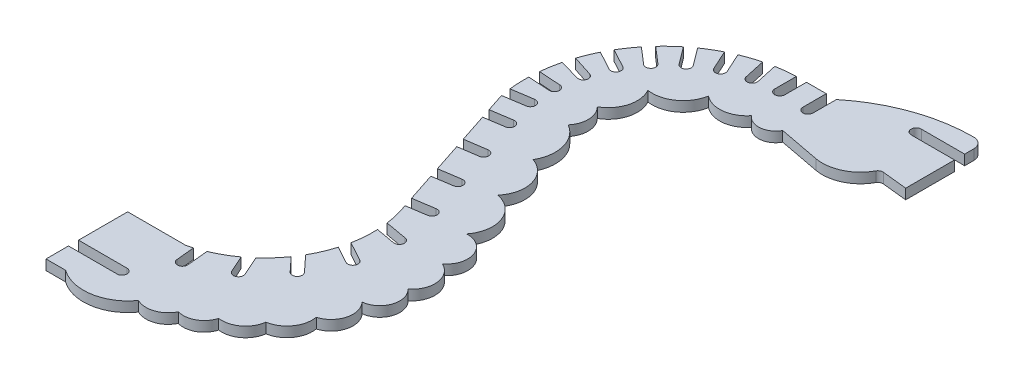
from build123d import *

# Parameters (mm, degrees)
BOSS_EXTRUDE1_DEPTH = 3


with BuildPart() as part:
    # Sketch3 → Boss-Extrude1 (new body)
    with BuildSketch(Plane(origin=(0, 0, 0), x_dir=(1, 0, 0), z_dir=(0, 1, 0))):
        with BuildLine():
            Line((0.591679445, -30.420098318), (0.591679445, -37.330098318))
            ThreePointArc((0.591679445, -37.330098318), (-0.908320555, -38.830098318), (-2.408320555, -37.330098318))
            Line((-2.408320555, -37.330098318), (-2.408320555, -30.420098318))
            Line((-2.408320555, -30.420098318), (-8.258320555, -30.420098318))
            Line((-8.258320555, -30.420098318), (-8.258320555, -36.830098318))
            ThreePointArc((-8.258320555, -36.830098318), (-9.758320555, -38.330098318), (-11.258320555, -36.830098318))
            Line((-11.258320555, -36.830098318), (-11.258320555, -30.420098318))
            ThreePointArc((-11.258320555, -30.420098318), (-14.157587017, -30.629396859), (-17.034731178, -31.04363517))
            Line((-17.034731178, -31.04363517), (-15.66681067, -37.305974468))
            ThreePointArc((-15.66681067, -37.305974468), (-16.812150481, -39.091526685), (-18.597702697, -37.946186875))
            Line((-18.597702697, -37.946186875), (-19.965623205, -31.683847576))
            ThreePointArc((-19.965623205, -31.683847576), (-22.753437017, -32.507040171), (-25.475903143, -33.525730554))
            Line((-25.475903143, -33.525730554), (-22.803084936, -39.351890767))
            ThreePointArc((-22.803084936, -39.351890767), (-23.540996482, -41.340731271), (-25.529836986, -40.602819725))
            Line((-25.529836986, -40.602819725), (-28.202655193, -34.776659512))
            ThreePointArc((-28.202655193, -34.776659512), (-30.750576247, -36.175820045), (-33.192934927, -37.752029415))
            Line((-33.192934927, -37.752029415), (-29.338361053, -42.873587796))
            ThreePointArc((-29.338361053, -42.873587796), (-29.634847287, -44.974086764), (-31.735346255, -44.67760053))
            Line((-31.735346255, -44.67760053), (-35.589920129, -39.556042149))
            ThreePointArc((-35.589920129, -39.556042149), (-37.780560653, -41.466708522), (-39.830287583, -43.52781779))
            Line((-39.830287583, -43.52781779), (-34.9715459, -47.708813994))
            ThreePointArc((-34.9715459, -47.708813994), (-34.812947114, -49.824197275), (-36.928330395, -49.982796061))
            Line((-36.928330395, -49.982796061), (-41.787072078, -45.801799857))
            ThreePointArc((-41.787072078, -45.801799857), (-43.519504922, -48.135943884), (-45.082165119, -50.586993661))
            Line((-45.082165119, -50.586993661), (-39.443107485, -53.634800906))
            ThreePointArc((-39.443107485, -53.634800906), (-38.836730639, -55.6676086), (-40.869538333, -56.273985446))
            Line((-40.869538333, -56.273985446), (-46.508595967, -53.226178201))
            ThreePointArc((-46.508595967, -53.226178201), (-47.665748765, -55.785413628), (-48.644932096, -58.417881781))
            Line((-48.644932096, -58.417881781), (-42.547032105, -60.378526572))
            ThreePointArc((-42.547032105, -60.378526572), (-41.520814182, -62.235103199), (-43.37739081, -63.261321122))
            Line((-43.37739081, -63.261321122), (-49.536961833, -61.487121356))
            ThreePointArc((-49.536961833, -61.487121356), (-50.138317317, -64.33104883), (-50.536616569, -67.210442795))
            Line((-50.536616569, -67.210442795), (-44.140315801, -67.629294183))
            ThreePointArc((-44.140315801, -67.629294183), (-42.741536695, -69.22410358), (-44.336346092, -70.622882686))
            Line((-44.336346092, -70.622882686), (-50.73264686, -70.204031298))
            ThreePointArc((-50.73264686, -70.204031298), (-50.713243641, -73.110777832), (-50.487893094, -76.008840811))
            Line((-50.487893094, -76.008840811), (-44.149552834, -75.053046508))
            ThreePointArc((-44.149552834, -75.053046508), (-42.442657071, -76.312612644), (-43.702223207, -78.019508408))
            Line((-43.702223207, -78.019508408), (-50.040563467, -78.975302711))
            Line((-50.040563467, -78.975302711), (-48.242175426, -84.448330276))
            Line((-48.242175426, -84.448330276), (-41.903835167, -83.492535972))
            ThreePointArc((-41.903835167, -83.492535972), (-40.196939403, -84.752102109), (-41.456505539, -86.458997873))
            Line((-41.456505539, -86.458997873), (-47.292325887, -87.339014346))
            Line((-47.292325887, -87.339014346), (-44.496146078, -95.848648873))
            Line((-44.496146078, -95.848648873), (-38.157805818, -94.89285457))
            ThreePointArc((-38.157805818, -94.89285457), (-36.450910055, -96.152420706), (-37.710476191, -97.85931647))
            Line((-37.710476191, -97.85931647), (-43.546296539, -98.739332944))
            Line((-43.546296539, -98.739332944), (-40.75011673, -107.248967471))
            Line((-40.75011673, -107.248967471), (-34.41177647, -106.293173167))
            ThreePointArc((-34.41177647, -106.293173167), (-32.704880706, -107.552739304), (-33.964446843, -109.259635067))
            Line((-33.964446843, -109.259635067), (-39.800267191, -110.139651541))
            Line((-39.800267191, -110.139651541), (-37.004087382, -118.649286068))
            Line((-37.004087382, -118.649286068), (-30.665747122, -117.693491765))
            ThreePointArc((-30.665747122, -117.693491765), (-28.958851358, -118.953057901), (-30.218417495, -120.659953665))
            Line((-30.218417495, -120.659953665), (-36.054237843, -121.539970138))
            Line((-36.054237843, -121.539970138), (-35.590669818, -122.95075011))
            ThreePointArc((-35.590669818, -122.95075011), (-34.806974696, -125.75946708), (-34.281042725, -128.627648207))
            Line((-34.281042725, -128.627648207), (-27.747875517, -129.78272529))
            ThreePointArc((-27.747875517, -129.78272529), (-26.531936776, -131.520969513), (-28.270180998, -132.736908254))
            Line((-28.270180998, -132.736908254), (-34.00913019, -131.722250511))
            ThreePointArc((-34.00913019, -131.722250511), (-34.075192309, -135.400732769), (-34.561150831, -139.04757253))
            Line((-34.561150831, -139.04757253), (-28.838758854, -142.17116811))
            ThreePointArc((-28.838758854, -142.17116811), (-28.240821524, -144.206474217), (-30.276127631, -144.804411546))
            Line((-30.276127631, -144.804411546), (-35.2935191, -142.065643934))
            ThreePointArc((-35.2935191, -142.065643934), (-36.539745877, -145.545336545), (-38.177184694, -148.858965366))
            Line((-38.177184694, -148.858965366), (-33.824418851, -153.564444036))
            ThreePointArc((-33.824418851, -153.564444036), (-33.906956954, -155.68415804), (-36.026670958, -155.601619937))
            Line((-36.026670958, -155.601619937), (-39.838521376, -151.480888091))
            ThreePointArc((-39.838521376, -151.480888091), (-42.144817333, -154.387016255), (-44.770614017, -157.008041575))
            Line((-44.770614017, -157.008041575), (-42.183941003, -162.772154464))
            ThreePointArc((-42.183941003, -162.772154464), (-42.938330746, -164.754803226), (-44.920979509, -164.000413483))
            Line((-44.920979509, -164.000413483), (-47.185290179, -158.954649194))
            ThreePointArc((-47.185290179, -158.954649194), (-50.311989567, -160.96907207), (-53.650455908, -162.608825429))
            Line((-53.650455908, -162.608825429), (-53.043901057, -168.832254262))
            ThreePointArc((-53.043901057, -168.832254262), (-54.391321871, -170.470685569), (-56.029753178, -169.123264755))
            Line((-56.029753178, -169.123264755), (-56.560978983, -163.672733804))
            ThreePointArc((-56.560978983, -163.672733804), (-57.462718747, -163.939470451), (-58.371875015, -164.179715994))
            Line((-58.371875015, -164.179715994), (-75.571875015, -164.179715994))
            Line((-75.571875015, -164.179715994), (-75.571875015, -178.729715994))
            Line((-75.571875015, -178.729715994), (-61.216696476, -178.729715994))
            ThreePointArc((-61.216696476, -178.729715994), (-59.722431212, -180.360755387), (-61.477773293, -181.706820898))
            Line((-61.477773293, -181.706820898), (-75.571875015, -181.706820898))
            Line((-75.571875015, -181.706820898), (-75.571875015, -188.366820898))
            Line((-75.571875015, -188.366820898), (-69.758711754, -188.366820898))
            ThreePointArc((-69.758711754, -188.366820898), (-59.859029923, -190.690063204), (-51.226648029, -185.315759714))
            ThreePointArc((-51.226648029, -185.315759714), (-46.206239367, -185.643710412), (-42.424378195, -182.325641566))
            ThreePointArc((-42.424378195, -182.325641566), (-37.700409933, -181.777039638), (-34.747980084, -178.048769502))
            ThreePointArc((-34.747980084, -178.048769502), (-29.512633217, -176.679893654), (-26.778625341, -172.010002988))
            ThreePointArc((-26.778625341, -172.010002988), (-21.874415441, -168.945099351), (-20.57382951, -163.310085129))
            ThreePointArc((-20.57382951, -163.310085129), (-16.135510008, -158.759996314), (-17.712581879, -152.602494179))
            ThreePointArc((-17.712581879, -152.602494179), (-12.736952388, -148.661636396), (-14.20790203, -142.487208808))
            ThreePointArc((-14.20790203, -142.487208808), (-11.660768143, -136.316062867), (-15.601751117, -130.927223803))
            ThreePointArc((-15.601751117, -130.927223803), (-13.478300165, -123.764089753), (-19.712761754, -119.646927859))
            ThreePointArc((-19.712761754, -119.646927859), (-18.260622737, -110.862232301), (-25.024542476, -105.071811459))
            ThreePointArc((-25.024542476, -105.071811459), (-23.152070063, -96.871086954), (-28.913917519, -90.742534985))
            ThreePointArc((-28.913917519, -90.742534985), (-27.85022737, -82.916745733), (-32.6317535, -76.630934567))
            ThreePointArc((-32.6317535, -76.630934567), (-31.035937746, -72.094286151), (-32.956658516, -67.685359014))
            ThreePointArc((-32.956658516, -67.685359014), (-28.901785775, -62.503538673), (-29.698658066, -55.972210359))
            ThreePointArc((-29.698658066, -55.972210359), (-22.933977183, -54.354119985), (-19.255807876, -48.450714658))
            ThreePointArc((-19.255807876, -48.450714658), (-13.273954555, -50.167914793), (-7.839177287, -47.135664555))
            ThreePointArc((-7.839177287, -47.135664555), (-3.40315163, -48.973344156), (0.591679445, -46.309378199))
            Line((0.591679445, -46.309378199), (12.675221537, -48.606938304))
            ThreePointArc((12.675221537, -48.606938304), (19.637576869, -47.715252301), (24.735359205, -42.890098318))
            ThreePointArc((24.735359205, -42.890098318), (25.355154173, -42.278520936), (26.210254983, -42.114279345))
            Line((26.210254983, -42.114279345), (33.591679445, -42.890098318))
            Line((33.591679445, -42.890098318), (33.591679445, -28.420098318))
            Line((33.591679445, -28.420098318), (20.741679445, -28.420098318))
            ThreePointArc((20.741679445, -28.420098318), (19.241679445, -26.920098318), (20.741679445, -25.420098318))
            Line((20.741679445, -25.420098318), (33.591679445, -25.420098318))
            Line((33.591679445, -25.420098318), (33.591679445, -22.706623157))
            ThreePointArc((33.591679445, -22.706623157), (32.712999789, -20.585302814), (30.591679445, -19.706623157))
            ThreePointArc((30.591679445, -19.706623157), (14.663884949, -22.465339604), (0.591679445, -30.420098318))
        make_face()
    extrude(amount=BOSS_EXTRUDE1_DEPTH)


solid = part.part
